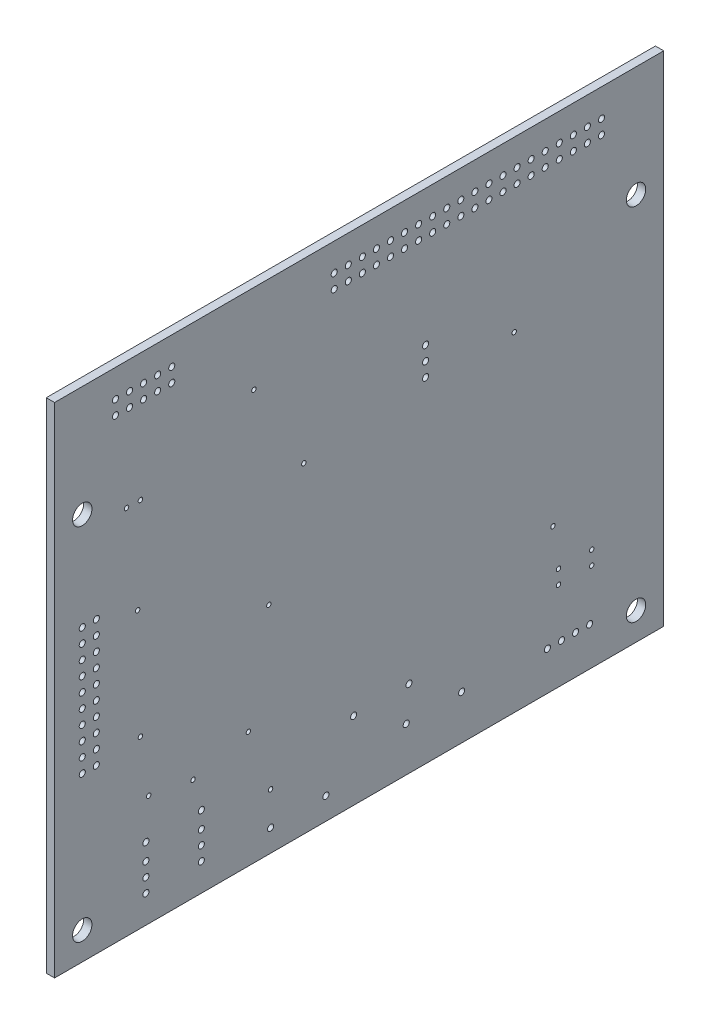
from build123d import *

# Parameters (mm, degrees)
SKETCH_1_W          = 110
SKETCH_1_H          = 90
SKETCH_1_R          = 1.75
EXTRUDE_1_DEPTH     = 1.5
SKETCH_2_R          = 0.55
CUT_EXTRUDE_1_DEPTH = 10
SKETCH_4_R          = 0.55
CUT_EXTRUDE_3_DEPTH = 10
SKETCH_5_R          = 0.4
CUT_EXTRUDE_4_DEPTH = 10
SKETCH_6_R          = 0.55
SKETCH_6_R_2        = 0.4
CUT_EXTRUDE_5_DEPTH = 10
SKETCH_7_R          = 0.4
CUT_EXTRUDE_6_DEPTH = 10


with BuildPart() as part:
    # Эскиз1 → Вытянуть1 (new body)
    with BuildSketch(Plane(origin=(0, 0, 0), x_dir=(0, 0, -1), z_dir=(1, 0, 0))):
        with Locations((-20, 0)):
            Rectangle(SKETCH_1_W, SKETCH_1_H)
        with Locations((-70, 25)):
            Circle(SKETCH_1_R, mode=Mode.SUBTRACT)
        with Locations((-70, -40)):
            Circle(SKETCH_1_R, mode=Mode.SUBTRACT)
        with Locations(Location((30, -40, 0), (0, 0, 180))):
            Circle(SKETCH_1_R, mode=Mode.SUBTRACT)
        with Locations(Location((30, 25, 0), (0, 0, 180))):
            Circle(SKETCH_1_R, mode=Mode.SUBTRACT)
    extrude(amount=EXTRUDE_1_DEPTH)

    # Эскиз2 → Вырез-Вытянуть1 (cut)
    with BuildSketch(Plane(origin=(1.5, 0, 0), x_dir=(0, 0, -1), z_dir=(1, 0, 0))):
        with Locations((-70, 7.335)):
            Circle(SKETCH_2_R)
        with Locations((-67.46, 7.335)):
            Circle(SKETCH_2_R)
        with Locations((-70, 4.795)):
            Circle(SKETCH_2_R)
        with Locations((-67.46, 4.795)):
            Circle(SKETCH_2_R)
        with Locations((-70, 2.255)):
            Circle(SKETCH_2_R)
        with Locations((-67.46, 2.255)):
            Circle(SKETCH_2_R)
        with Locations((-70, -0.285)):
            Circle(SKETCH_2_R)
        with Locations((-67.46, -0.285)):
            Circle(SKETCH_2_R)
        with Locations((-70, -2.825)):
            Circle(SKETCH_2_R)
        with Locations((-67.46, -2.825)):
            Circle(SKETCH_2_R)
        with Locations((-70, -5.365)):
            Circle(SKETCH_2_R)
        with Locations((-67.46, -5.365)):
            Circle(SKETCH_2_R)
        with Locations((-70, -7.905)):
            Circle(SKETCH_2_R)
        with Locations((-67.46, -7.905)):
            Circle(SKETCH_2_R)
        with Locations((-70, -10.445)):
            Circle(SKETCH_2_R)
        with Locations((-67.46, -10.445)):
            Circle(SKETCH_2_R)
        with Locations((-70, -12.985)):
            Circle(SKETCH_2_R)
        with Locations((-67.46, -12.985)):
            Circle(SKETCH_2_R)
        with Locations((-70, -15.525)):
            Circle(SKETCH_2_R)
        with Locations((-67.46, -15.525)):
            Circle(SKETCH_2_R)
        with Locations((-64, 40)):
            Circle(SKETCH_2_R)
        with Locations((-64, 37.46)):
            Circle(SKETCH_2_R)
        with Locations((-61.46, 40)):
            Circle(SKETCH_2_R)
        with Locations((-61.46, 37.46)):
            Circle(SKETCH_2_R)
        with Locations((-58.92, 40)):
            Circle(SKETCH_2_R)
        with Locations((-58.92, 37.46)):
            Circle(SKETCH_2_R)
        with Locations((-56.38, 40)):
            Circle(SKETCH_2_R)
        with Locations((-56.38, 37.46)):
            Circle(SKETCH_2_R)
        with Locations((-53.84, 40)):
            Circle(SKETCH_2_R)
        with Locations((-53.84, 37.46)):
            Circle(SKETCH_2_R)
        with Locations((-24.5, 40)):
            Circle(SKETCH_2_R)
        with Locations((-24.5, 37.46)):
            Circle(SKETCH_2_R)
        with Locations((-21.96, 40)):
            Circle(SKETCH_2_R)
        with Locations((-21.96, 37.46)):
            Circle(SKETCH_2_R)
        with Locations((-19.42, 40)):
            Circle(SKETCH_2_R)
        with Locations((-19.42, 37.46)):
            Circle(SKETCH_2_R)
        with Locations((-16.88, 40)):
            Circle(SKETCH_2_R)
        with Locations((-16.88, 37.46)):
            Circle(SKETCH_2_R)
        with Locations((-14.34, 40)):
            Circle(SKETCH_2_R)
        with Locations((-14.34, 37.46)):
            Circle(SKETCH_2_R)
        with Locations((-11.8, 40)):
            Circle(SKETCH_2_R)
        with Locations((-11.8, 37.46)):
            Circle(SKETCH_2_R)
        with Locations((-9.26, 40)):
            Circle(SKETCH_2_R)
        with Locations((-9.26, 37.46)):
            Circle(SKETCH_2_R)
        with Locations((-6.72, 40)):
            Circle(SKETCH_2_R)
        with Locations((-6.72, 37.46)):
            Circle(SKETCH_2_R)
        with Locations((-4.18, 40)):
            Circle(SKETCH_2_R)
        with Locations((-4.18, 37.46)):
            Circle(SKETCH_2_R)
        with Locations((-1.64, 40)):
            Circle(SKETCH_2_R)
        with Locations((-1.64, 37.46)):
            Circle(SKETCH_2_R)
        with Locations((0.9, 40)):
            Circle(SKETCH_2_R)
        with Locations((0.9, 37.46)):
            Circle(SKETCH_2_R)
        with Locations((3.44, 40)):
            Circle(SKETCH_2_R)
        with Locations((3.44, 37.46)):
            Circle(SKETCH_2_R)
        with Locations((5.98, 40)):
            Circle(SKETCH_2_R)
        with Locations((5.98, 37.46)):
            Circle(SKETCH_2_R)
        with Locations((8.52, 40)):
            Circle(SKETCH_2_R)
        with Locations((8.52, 37.46)):
            Circle(SKETCH_2_R)
        with Locations((11.06, 40)):
            Circle(SKETCH_2_R)
        with Locations((11.06, 37.46)):
            Circle(SKETCH_2_R)
        with Locations((13.6, 40)):
            Circle(SKETCH_2_R)
        with Locations((13.6, 37.46)):
            Circle(SKETCH_2_R)
        with Locations((16.14, 40)):
            Circle(SKETCH_2_R)
        with Locations((16.14, 37.46)):
            Circle(SKETCH_2_R)
        with Locations((18.68, 40)):
            Circle(SKETCH_2_R)
        with Locations((18.68, 37.46)):
            Circle(SKETCH_2_R)
        with Locations((21.22, 40)):
            Circle(SKETCH_2_R)
        with Locations((21.22, 37.46)):
            Circle(SKETCH_2_R)
        with Locations((23.76, 40)):
            Circle(SKETCH_2_R)
        with Locations((23.76, 37.46)):
            Circle(SKETCH_2_R)
        with Locations((-8, 20.5)):
            Circle(SKETCH_2_R)
        with Locations((-8, 17.96)):
            Circle(SKETCH_2_R)
        with Locations((-8, 15.42)):
            Circle(SKETCH_2_R)
        with Locations((50.03, -40.002)):
            Circle(SKETCH_2_R)
        with Locations((51.180392552, -42.266552268)):
            Circle(SKETCH_2_R)
        with Locations((52.330785105, -44.531104537)):
            Circle(SKETCH_2_R)
        with Locations((53.481177657, -46.795656805)):
            Circle(SKETCH_2_R)
    extrude(amount=-CUT_EXTRUDE_1_DEPTH, mode=Mode.SUBTRACT)

    # Эскиз4 → Вырез-Вытянуть3 (cut)
    with BuildSketch(Plane(origin=(1.5, 0, 0), x_dir=(0, 0, -1), z_dir=(1, 0, 0))):
        with Locations((14, -38)):
            Circle(SKETCH_4_R)
        with Locations((16.54, -38)):
            Circle(SKETCH_4_R)
        with Locations((19.08, -38)):
            Circle(SKETCH_4_R)
        with Locations((21.62, -38)):
            Circle(SKETCH_4_R)
    extrude(amount=-CUT_EXTRUDE_3_DEPTH, mode=Mode.SUBTRACT)

    # Эскиз5 → Вырез-Вытянуть4 (cut)
    with BuildSketch(Plane(origin=(1.5, 0, 0), x_dir=(0, 0, -1), z_dir=(1, 0, 0))):
        with Locations((15, -19.35)):
            Circle(SKETCH_5_R)
        with Locations((-30, 13)):
            Circle(SKETCH_5_R)
        with Locations((8, 14.5)):
            Circle(SKETCH_5_R)
        with Locations((-36, -35)):
            Circle(SKETCH_5_R)
        with Locations((-40, -24)):
            Circle(SKETCH_5_R)
        with Locations((-60, 5)):
            Circle(SKETCH_5_R)
        with Locations((-62, 22)):
            Circle(SKETCH_5_R)
        with Locations((-59.5, 22)):
            Circle(SKETCH_5_R)
        with Locations((16, -29)):
            Circle(SKETCH_5_R)
        with Locations((22, -29)):
            Circle(SKETCH_5_R)
        with Locations((22, -26.5)):
            Circle(SKETCH_5_R)
        with Locations((16, -26.5)):
            Circle(SKETCH_5_R)
        with Locations((-50, -26.5)):
            Circle(SKETCH_5_R)
    extrude(amount=-CUT_EXTRUDE_4_DEPTH, mode=Mode.SUBTRACT)

    # Эскиз6 → Вырез-Вытянуть5 (cut)
    with BuildSketch(Plane(origin=(1.5, 0, 0), x_dir=(0, 0, -1), z_dir=(1, 0, 0))):
        with Locations((-58.5, -40)):
            Circle(SKETCH_6_R)
        with Locations((-48.5, -40)):
            Circle(SKETCH_6_R)
        with Locations((-58.5, -37.5)):
            Circle(SKETCH_6_R)
        with Locations((-48.5, -37.5)):
            Circle(SKETCH_6_R)
        with Locations((-58.5, -35)):
            Circle(SKETCH_6_R)
        with Locations((-48.5, -35)):
            Circle(SKETCH_6_R)
        with Locations((-58.5, -32)):
            Circle(SKETCH_6_R)
        with Locations((-48.5, -32)):
            Circle(SKETCH_6_R)
        with Locations((-36, -41)):
            Circle(SKETCH_6_R)
        with Locations((-26, -41)):
            Circle(SKETCH_6_R)
        with Locations((-11.5, -37)):
            Circle(SKETCH_6_R)
        with Locations((-1.5, -37)):
            Circle(SKETCH_6_R)
        with Locations((-21, -31)):
            Circle(SKETCH_6_R)
        with Locations((-11, -31)):
            Circle(SKETCH_6_R)
        with Locations((-39, 29)):
            Circle(SKETCH_6_R_2)
        with Locations((-58, -25)):
            Circle(SKETCH_6_R_2)
        with Locations((-59.5, -15)):
            Circle(SKETCH_6_R_2)
    extrude(amount=-CUT_EXTRUDE_5_DEPTH, mode=Mode.SUBTRACT)

    # Эскиз7 → Вырез-Вытянуть6 (cut)
    with BuildSketch(Plane(origin=(1.5, 0, 0), x_dir=(0, 0, -1), z_dir=(1, 0, 0))):
        with Locations((-36.3, -6)):
            Circle(SKETCH_7_R)
    extrude(amount=-CUT_EXTRUDE_6_DEPTH, mode=Mode.SUBTRACT)


solid = part.part
